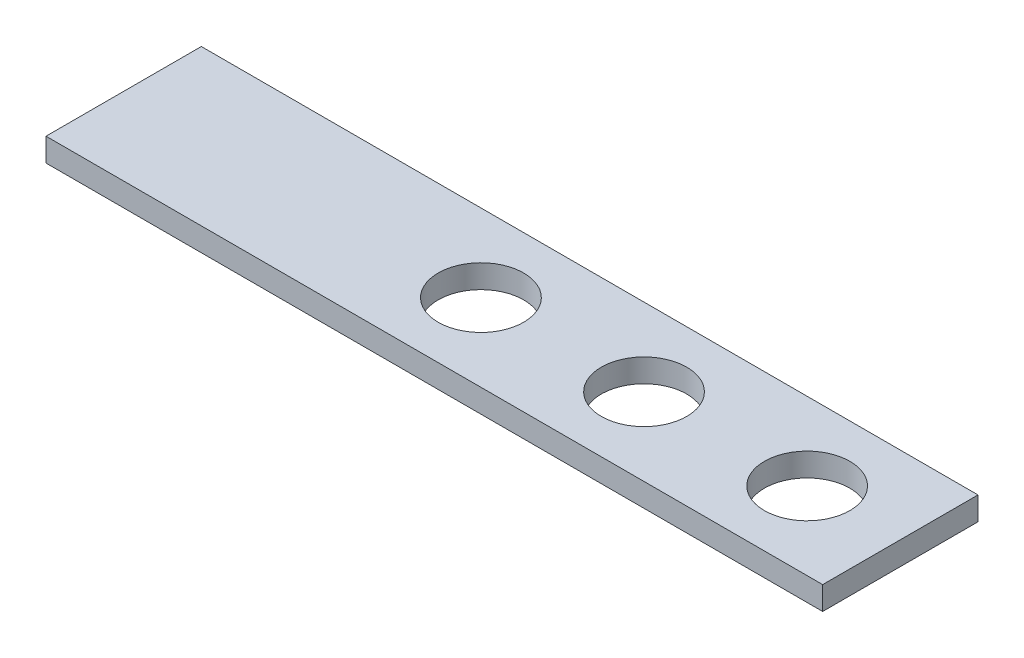
from build123d import *

# Parameters (mm, degrees)
SKETCH1_W           = 100
SKETCH1_H           = 20
SKETCH1_R           = 5.5
BOSS_EXTRUDE1_DEPTH = 3


with BuildPart() as part:
    # Sketch1 → Boss-Extrude1 (new body)
    with BuildSketch(Plane(origin=(0, 0, 0), x_dir=(1, 0, 0), z_dir=(0, 1, 0))):
        with Locations((50, 10)):
            Rectangle(SKETCH1_W, SKETCH1_H)
        with Locations(Location((46, 10, 0), (0, 0, 270))):
            Circle(SKETCH1_R, mode=Mode.SUBTRACT)
        with Locations(Location((67, 10, 0), (0, 0, 270))):
            Circle(SKETCH1_R, mode=Mode.SUBTRACT)
        with Locations(Location((88, 10, 0), (0, 0, 270))):
            Circle(SKETCH1_R, mode=Mode.SUBTRACT)
    extrude(amount=BOSS_EXTRUDE1_DEPTH)


solid = part.part
